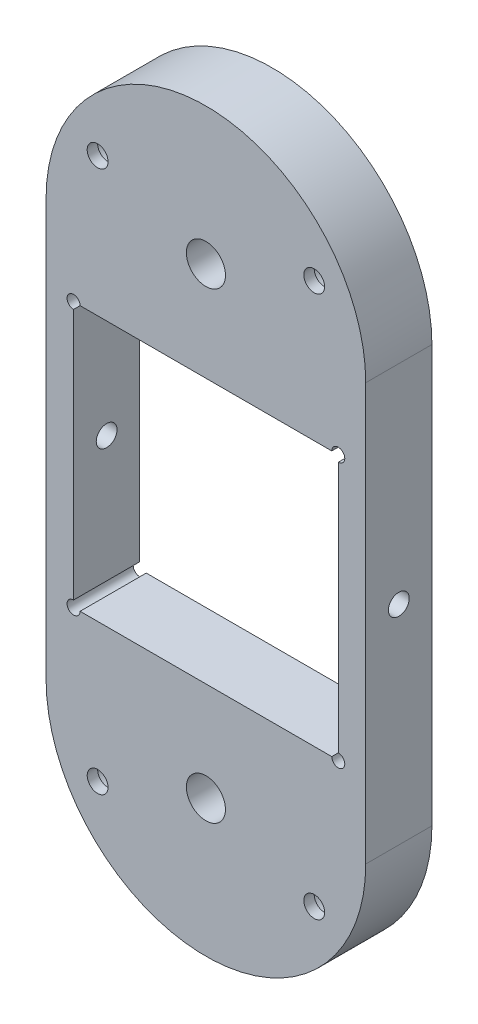
from build123d import *

# Parameters (mm, degrees)
SKETCH1_R           = 27.5
BOSS_EXTRUDE1_DEPTH = 12.7
BOSS_EXTRUDE2_START = -12.7
SKETCH2_R           = 2
BOSS_EXTRUDE2_DEPTH = 12.7
SKETCH7_R           = 2
CUT_EXTRUDE4_DEPTH  = 85
SKETCH8_R           = 2.5
SKETCH8_W           = 50.8
SKETCH8_H           = 50.8
CUT_EXTRUDE5_DEPTH  = 12.7
SKETCH9_R           = 1.25
CUT_EXTRUDE6_DEPTH  = 12.7
SKETCH10_R          = 3.75
CUT_EXTRUDE7_DEPTH  = 10.7
SKETCH11_R          = 3.75
CUT_EXTRUDE8_DEPTH  = 10.7


with BuildPart() as part:
    # Sketch1 → Boss-Extrude1 (new body)
    with BuildSketch(Plane.XY):
        with BuildLine():
            Line((30.675000233, 40), (30.675000233, -40))
            ThreePointArc((30.675000233, -40), (0, -70.675000233), (-30.675000233, -40))
            Line((-30.675000233, -40), (-30.675000233, 40))
            ThreePointArc((-30.675000233, 40), (0, 70.675000233), (30.675000233, 40))
        make_face()
        with Locations((0, -40)):
            Circle(SKETCH1_R, mode=Mode.SUBTRACT)
        with Locations(Location((0, 40, 0), (0, 0, 180))):
            Circle(SKETCH1_R, mode=Mode.SUBTRACT)
    extrude(amount=BOSS_EXTRUDE1_DEPTH)

    # Sketch2 → Boss-Extrude2 (add)
    with BuildSketch(Plane.XY.offset(12.7).offset(BOSS_EXTRUDE2_START)):
        with BuildLine():
            Line((-30.675000233, 40), (-30.675000233, -40))
            ThreePointArc((-30.675000233, -40), (0, -70.675000233), (30.675000233, -40))
            Line((30.675000233, -40), (30.675000233, 40))
            ThreePointArc((30.675000233, 40), (0, 70.675000233), (-30.675000233, 40))
        make_face()
        with Locations((20.784609691, 52)):
            Circle(SKETCH2_R, mode=Mode.SUBTRACT)
        with Locations((-20.784609691, 52)):
            Circle(SKETCH2_R, mode=Mode.SUBTRACT)
        with Locations((-20.784609691, -52)):
            Circle(SKETCH2_R, mode=Mode.SUBTRACT)
        with Locations((20.784609691, -52)):
            Circle(SKETCH2_R, mode=Mode.SUBTRACT)
    extrude(amount=BOSS_EXTRUDE2_DEPTH)

    # Sketch7 → Cut-Extrude4 (cut)
    with BuildSketch(Plane.ZY.offset(30.675000233)):
        with Locations(Location((6.35, 0, 0), (0, 0, 270))):
            Circle(SKETCH7_R)
    extrude(amount=-CUT_EXTRUDE4_DEPTH, mode=Mode.SUBTRACT)

    # Sketch8 → Cut-Extrude5 (cut)
    with BuildSketch(Plane.XY.offset(12.7)):
        with Locations((0, 44.4)):
            Circle(SKETCH8_R)
        with Locations((0, -44.4)):
            Circle(SKETCH8_R)
        Rectangle(SKETCH8_W, SKETCH8_H)
    extrude(amount=-CUT_EXTRUDE5_DEPTH, mode=Mode.SUBTRACT)

    # Sketch9 → Cut-Extrude6 (cut)
    with BuildSketch(Plane(origin=(0, 0, 0), x_dir=(-1, 0, 0), z_dir=(0, 0, -1))):
        with Locations((-25.4, 25.4)):
            Circle(SKETCH9_R)
        with Locations((25.4, 25.4)):
            Circle(SKETCH9_R)
        with Locations((25.4, -25.4)):
            Circle(SKETCH9_R)
        with Locations((-25.4, -25.4)):
            Circle(SKETCH9_R)
    extrude(amount=-CUT_EXTRUDE6_DEPTH, mode=Mode.SUBTRACT)

    # Sketch10 → Cut-Extrude7 (cut)
    with BuildSketch(Plane(origin=(0, 0, 0), x_dir=(-1, 0, 0), z_dir=(0, 0, -1))):
        with Locations((-20.784609691, 52)):
            Circle(SKETCH10_R)
        with Locations(Location((20.784609691, 52, 0), (0, 0, 180))):
            Circle(SKETCH10_R)
        with Locations((20.784609691, -52)):
            Circle(SKETCH10_R)
        with Locations(Location((-20.784609691, -52, 0), (0, 0, 180))):
            Circle(SKETCH10_R)
    extrude(amount=-CUT_EXTRUDE7_DEPTH, mode=Mode.SUBTRACT)

    # Sketch11 → Cut-Extrude8 (cut)
    with BuildSketch(Plane.XY.offset(12.7)):
        with Locations((0, 44.4)):
            Circle(SKETCH11_R)
        with Locations((0, -44.4)):
            Circle(SKETCH11_R)
    extrude(amount=-CUT_EXTRUDE8_DEPTH, mode=Mode.SUBTRACT)


solid = part.part
